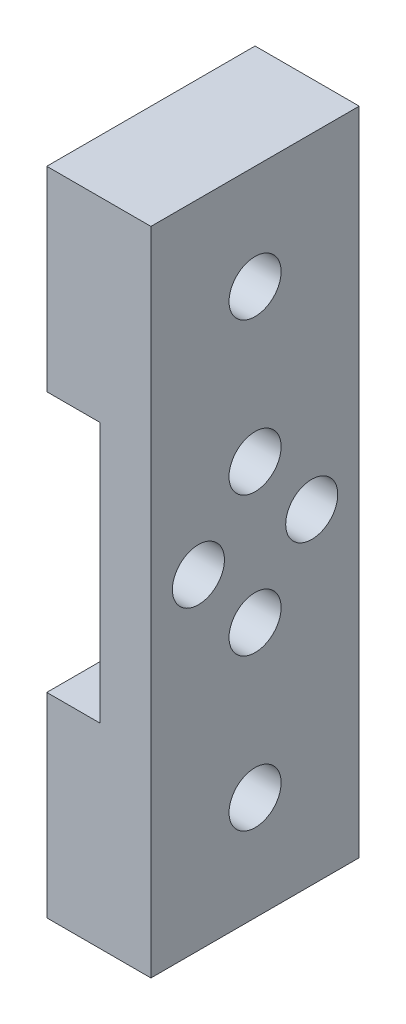
from build123d import *

# Parameters (mm, degrees)
BOSS_EXTRUDE1_DEPTH = 12.7
CUT_EXTRUDE1_REACH  = 45.562
SKETCH2_R           = 3.175
CUT_EXTRUDE2_REACH  = 44.17
SKETCH3_R           = 3.175


with BuildPart() as part:
    # Sketch1 → Boss-Extrude1 (new, symmetric)
    with BuildSketch(Plane.XY):
        Polygon((0, 39.6875), (0, 15.875), (6.477, 15.875), (6.477, -15.875), (0, -15.875), (0, -39.6875), (12.7, -39.6875), (12.7, 39.6875), align=None)
    extrude(amount=BOSS_EXTRUDE1_DEPTH, both=True)

    # Sketch2 → Cut-Extrude1 (cut, up to next)
    with BuildSketch(Plane.ZY, mode=Mode.PRIVATE) as cut_extrude1_sk1:
        with Locations(Location((0, 26.9875, 0), (0, 0, 270))):
            Circle(SKETCH2_R)
    cut_extrude1_tool1 = extrude(cut_extrude1_sk1.sketch, amount=-CUT_EXTRUDE1_REACH, mode=Mode.PRIVATE) & part.part
    cut_extrude1 = cut_extrude1_tool1.solids().sort_by_distance((0, 26.9875, 0))[0]
    add(cut_extrude1, mode=Mode.SUBTRACT)

    # Mirror1: Cut-Extrude1 across plane
    add(cut_extrude1.mirror(Plane.ZX), mode=Mode.SUBTRACT)

    # Sketch3 → Cut-Extrude2 (cut, up to next)
    with BuildSketch(Plane.ZY.offset(-6.477), mode=Mode.PRIVATE) as cut_extrude2_sk1:
        with Locations((0, 8.4963)):
            Circle(SKETCH3_R)
    cut_extrude2_tool1 = extrude(cut_extrude2_sk1.sketch, amount=-CUT_EXTRUDE2_REACH, mode=Mode.PRIVATE) & part.part
    # Sketch3 → Cut-Extrude2 (cut, up to next)
    with BuildSketch(Plane.ZY.offset(-6.477), mode=Mode.PRIVATE) as cut_extrude2_sk2:
        with Locations((0, -8.4963)):
            Circle(SKETCH3_R)
    cut_extrude2_tool2 = extrude(cut_extrude2_sk2.sketch, amount=-CUT_EXTRUDE2_REACH, mode=Mode.PRIVATE) & part.part
    # Sketch3 → Cut-Extrude2 (cut, up to next)
    with BuildSketch(Plane.ZY.offset(-6.477), mode=Mode.PRIVATE) as cut_extrude2_sk3:
        with Locations((6.908794346, 0.0125)):
            Circle(SKETCH3_R)
    cut_extrude2_tool3 = extrude(cut_extrude2_sk3.sketch, amount=-CUT_EXTRUDE2_REACH, mode=Mode.PRIVATE) & part.part
    # Sketch3 → Cut-Extrude2 (cut, up to next)
    with BuildSketch(Plane.ZY.offset(-6.477), mode=Mode.PRIVATE) as cut_extrude2_sk4:
        with Locations((-6.908805654, 0)):
            Circle(SKETCH3_R)
    cut_extrude2_tool4 = extrude(cut_extrude2_sk4.sketch, amount=-CUT_EXTRUDE2_REACH, mode=Mode.PRIVATE) & part.part
    add(cut_extrude2_tool1.solids().sort_by_distance((6.477, 8.4963, 0))[0], mode=Mode.SUBTRACT)
    add(cut_extrude2_tool2.solids().sort_by_distance((6.477, -8.4963, 0))[0], mode=Mode.SUBTRACT)
    add(cut_extrude2_tool3.solids().sort_by_distance((6.477, 0.0125, 6.908794))[0], mode=Mode.SUBTRACT)
    add(cut_extrude2_tool4.solids().sort_by_distance((6.477, 0, -6.908806))[0], mode=Mode.SUBTRACT)


solid = part.part
